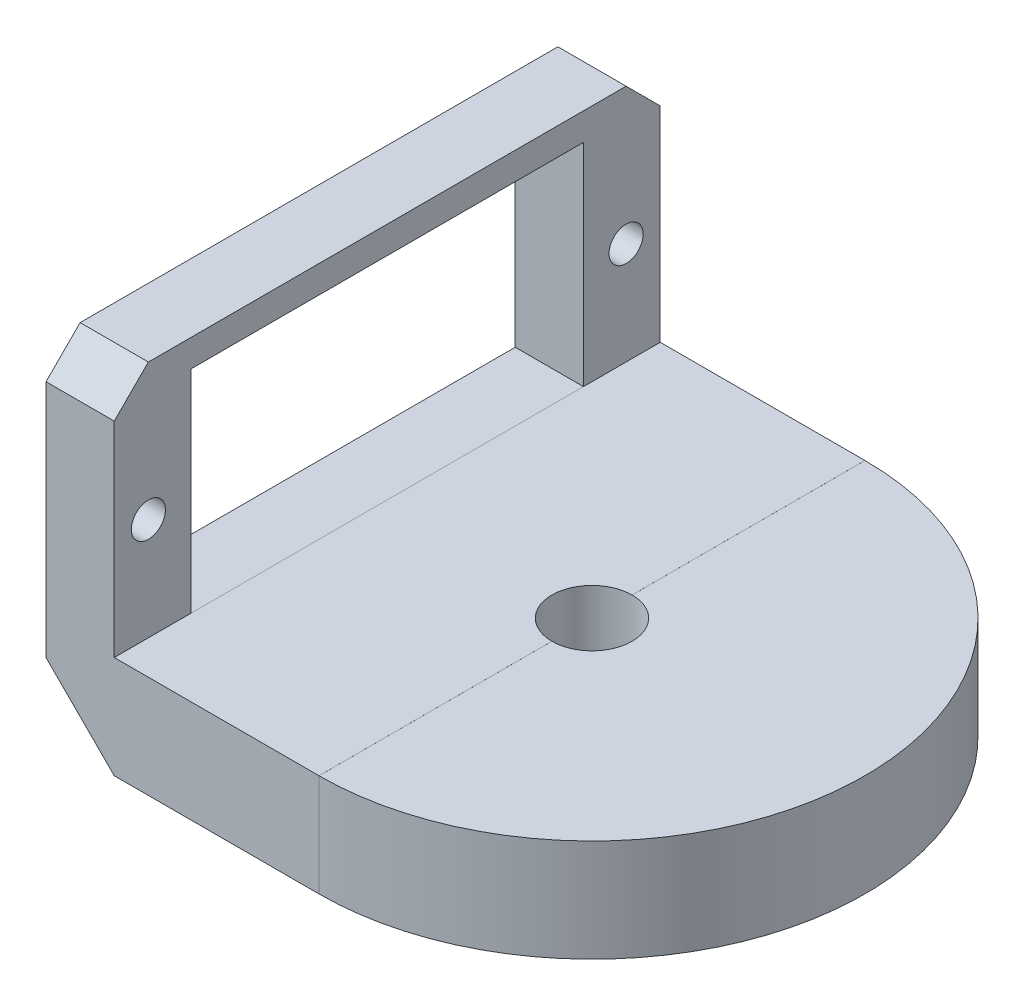
from build123d import *

# Parameters (mm, degrees)
SKETCH1_W                = 32
SKETCH1_H                = 16
SKETCH1_W_2              = 23
SKETCH1_H_2              = 12.8
BOSS_EXTRUDE1_DEPTH      = 4
SKETCH3_W                = 32
SKETCH3_H                = 2.001260946
BOSS_EXTRUDE3_DEPTH      = 12
BOSS_EXTRUDE5_DEPTH      = 4
BOSS_EXTRUDE5_DEPTH_BACK = 2
CHAMFER1_SIZE            = 4
SKETCH8_R                = 2.35
CUT_EXTRUDE2_DEPTH       = 50.477267507
SKETCH9_R                = 1
CUT_EXTRUDE3_DEPTH       = 49
CHAMFER2_SIZE            = 2


with BuildPart() as part:
    # Sketch1 → Boss-Extrude1 (new body)
    with BuildSketch(Plane(origin=(0, 0, 0), x_dir=(0, 0, -1), z_dir=(1, 0, 0))):
        with Locations((16, 8)):
            Rectangle(SKETCH1_W, SKETCH1_H)
        with Locations((16, 8)):
            Rectangle(SKETCH1_W_2, SKETCH1_H_2, mode=Mode.SUBTRACT)
    extrude(amount=BOSS_EXTRUDE1_DEPTH)

    # Sketch3 → Boss-Extrude3 (add)
    with BuildSketch(Plane(origin=(4, 0, 0), x_dir=(0, 0, -1), z_dir=(1, 0, 0))):
        with Locations((16, 1.000630473)):
            Rectangle(SKETCH3_W, SKETCH3_H)
    extrude(amount=BOSS_EXTRUDE3_DEPTH)

    # Sketch7 → Boss-Extrude5 (add, two sides: drawn at the far end of the back side and taken through both)
    with BuildSketch(Plane.XZ.offset(-BOSS_EXTRUDE5_DEPTH_BACK)):
        with BuildLine():
            Line((0, 0), (16, 0))
            ThreePointArc((16, 0), (32, -16), (16, -32))
            Line((16, -32), (0, -32))
            Line((0, -32), (0, 0))
        make_face()
    extrude(amount=BOSS_EXTRUDE5_DEPTH + BOSS_EXTRUDE5_DEPTH_BACK)

    # Chamfer1
    chamfer1_edges = [part.edges().sort_by_distance(p)[0] for p in [
        (0, -4, -16),
    ]]
    chamfer(chamfer1_edges, length=CHAMFER1_SIZE)

    # Sketch8 → Cut-Extrude2 (cut, through all)
    with BuildSketch(Plane.XZ.offset(4)):
        with Locations(Location((16, -16, 0), (0, 0, 270))):
            Circle(SKETCH8_R)
    extrude(amount=-CUT_EXTRUDE2_DEPTH, mode=Mode.SUBTRACT)

    # Sketch9 → Cut-Extrude3 (cut, through all)
    with BuildSketch(Plane.ZY):
        with Locations((-30, 8)):
            Circle(SKETCH9_R)
        with Locations((-2, 8)):
            Circle(SKETCH9_R)
    extrude(amount=-CUT_EXTRUDE3_DEPTH, mode=Mode.SUBTRACT)

    # Chamfer2
    chamfer2_edges = [part.edges().sort_by_distance(p)[0] for p in [
        (2, 16, 0),
        (2, 16, -32),
    ]]
    chamfer(chamfer2_edges, length=CHAMFER2_SIZE)


solid = part.part
